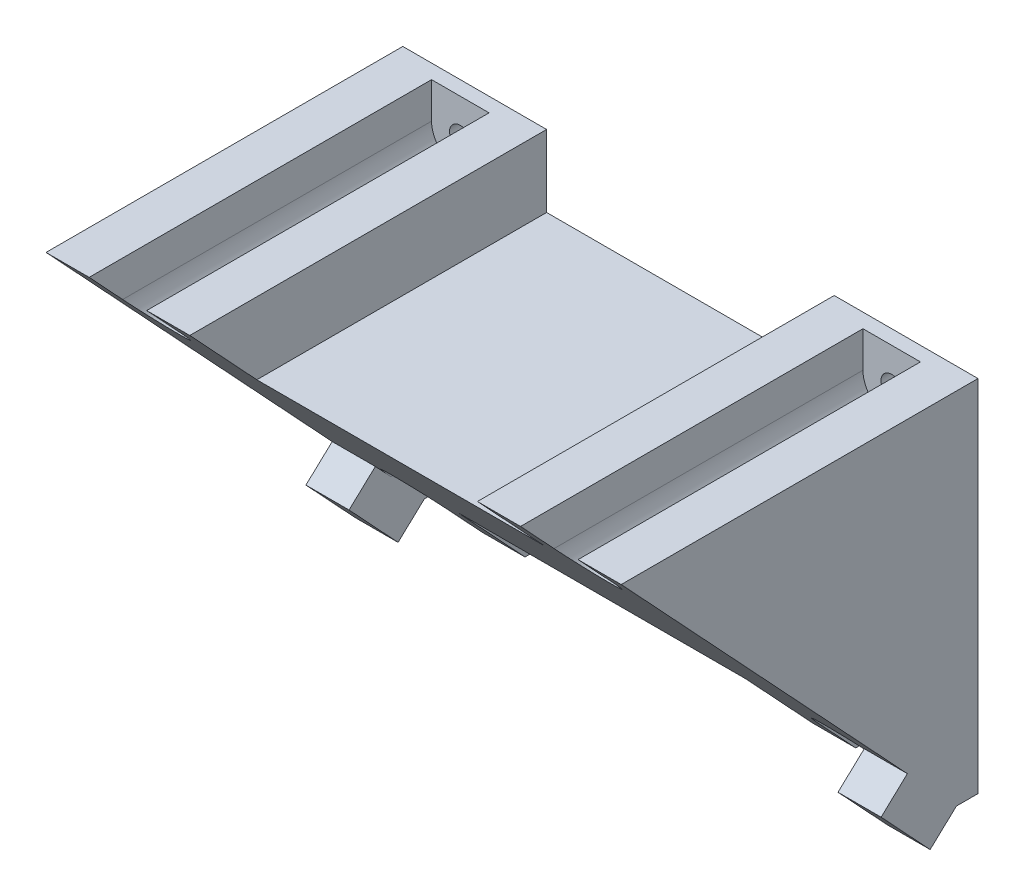
from build123d import *

# Parameters (mm, degrees)
EXTRUDE_2_DEPTH     = 2
SKETCH_3_R          = 1.5
CUT_EXTRUDE_1_DEPTH = 95.361008897
EXTRUDE_3_DEPTH     = 1
DRAFT_4_ANGLE       = 43
SKETCH_6_W          = 6
SKETCH_6_H          = 10
EXTRUDE_4_DEPTH     = 5
SKETCH_7_W          = 6
SKETCH_7_H          = 10
EXTRUDE_5_DEPTH     = 5


with BuildPart() as part:
    # 草图1 → 凸台-拉伸2 (new body)
    with BuildSketch(Plane.XY):
        Polygon((0, 0), (0, 50), (20, 50), (20, 40), (60, 40), (60, 50), (80, 50), (80, 0), (60, 0), (60, 10), (20, 10), (20, 0), align=None)
    extrude(amount=EXTRUDE_2_DEPTH)

    # 草图3 → 切除-拉伸1 (cut, through all)
    with BuildSketch(Plane.XY.offset(2)):
        with Locations((10, 45)):
            Circle(SKETCH_3_R)
        with Locations((10, 5)):
            Circle(SKETCH_3_R)
        with Locations((70, 45)):
            Circle(SKETCH_3_R)
        with Locations((70, 5)):
            Circle(SKETCH_3_R)
    extrude(amount=-CUT_EXTRUDE_1_DEPTH, mode=Mode.SUBTRACT)

    # 草图5 → 凸台-拉伸3 (add)
    with BuildSketch(Plane.XY.offset(2)):
        with BuildLine():
            Line((0, 50), (6, 50))
            Line((6, 50), (6, 45))
            ThreePointArc((6, 45), (10, 41), (14, 45))
            Line((14, 45), (14, 50))
            Line((14, 50), (20, 50))
            Line((20, 50), (20, 40))
            Line((20, 40), (60, 40))
            Line((60, 40), (60, 50))
            Line((60, 50), (66, 50))
            Line((66, 50), (66, 45))
            ThreePointArc((66, 45), (70, 41), (74, 45))
            Line((74, 45), (74, 50))
            Line((74, 50), (80, 50))
            Line((80, 50), (80, 0))
            Line((80, 0), (74, 0))
            Line((74, 0), (74, 5))
            ThreePointArc((74, 5), (70, 9), (66, 5))
            Line((66, 5), (66, 0))
            Line((66, 0), (60, 0))
            Line((60, 0), (60, 10))
            Line((60, 10), (20, 10))
            Line((20, 10), (20, 0))
            Line((20, 0), (14, 0))
            Line((14, 0), (14, 5))
            ThreePointArc((14, 5), (10, 9), (6, 5))
            Line((6, 5), (6, 0))
            Line((6, 0), (0, 0))
            Line((0, 0), (0, 50))
        make_face()
    extrude(amount=EXTRUDE_3_DEPTH)

    # 拔模4
    draft_4_faces = [part.faces().sort_by_distance(p)[0] for p in [
        (40, 25, 3),
    ]]
    draft(draft_4_faces, Plane(origin=(20, 0, 2), x_dir=(-1, 0, 0), z_dir=(0, -1, 0)), DRAFT_4_ANGLE)

    # 草图6 → 凸台-拉伸4 (add)
    with BuildSketch(Plane(origin=(0, -1.496346075, 1.604634711), x_dir=(1, 0, 0), z_dir=(0, -0.6819983600624997, 0.7313537016191695))):
        with Locations((3, 7.04599508)):
            Rectangle(SKETCH_6_W, SKETCH_6_H)
    extrude(amount=EXTRUDE_4_DEPTH)

    # 草图7 → 凸台-拉伸5 (add)
    with BuildSketch(Plane(origin=(0, -1.496346075, 1.604634711), x_dir=(1, 0, 0), z_dir=(0, -0.6819983600624997, 0.7313537016191695))):
        with Locations((77, 7.04599508)):
            Rectangle(SKETCH_7_W, SKETCH_7_H)
    extrude(amount=EXTRUDE_5_DEPTH)


solid = part.part
